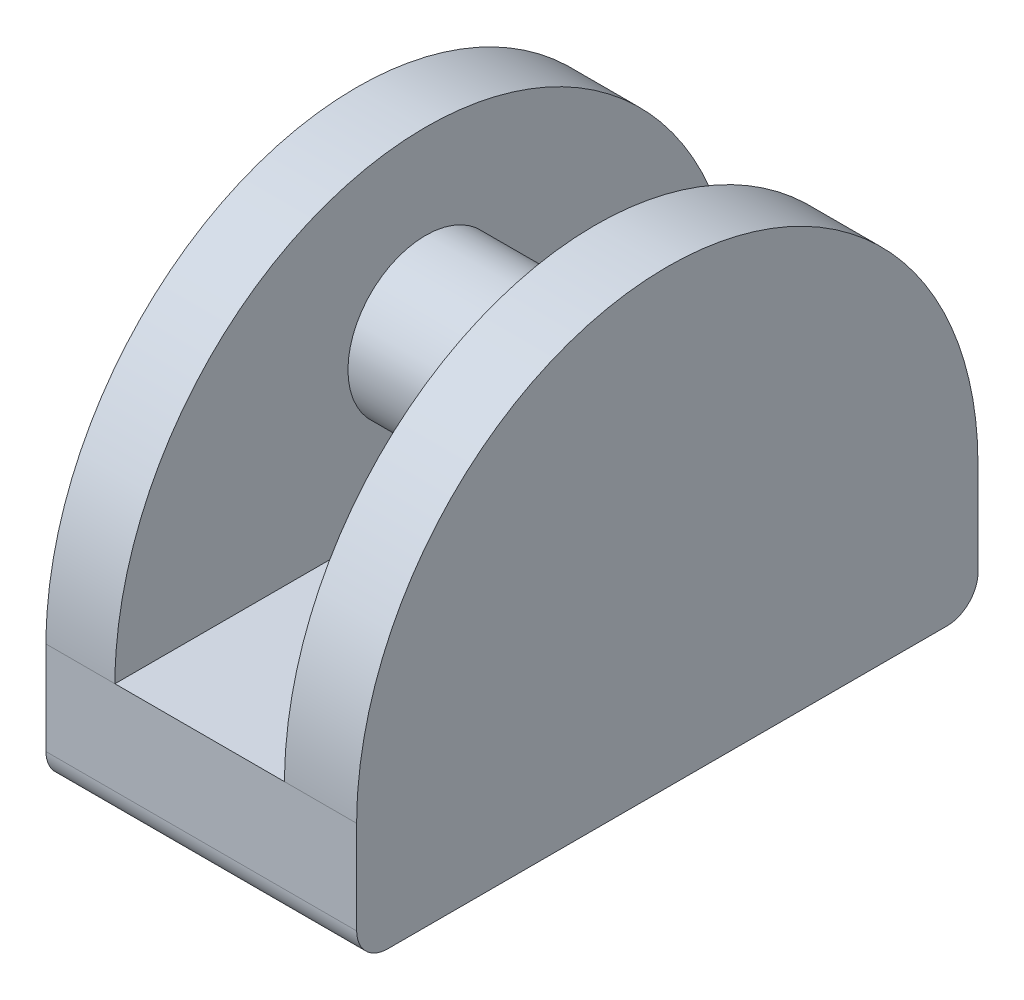
from build123d import *

# Parameters (mm, degrees)
SKETCH1_W           = 10
SKETCH1_H           = 2
BOSS_EXTRUDE1_DEPTH = 5
BOSS_EXTRUDE2_DEPTH = 5
SKETCH4_W           = 2.729572797
SKETCH4_H           = 10
CUT_EXTRUDE1_DEPTH  = 6
SKETCH5_R           = 1.25
BOSS_EXTRUDE3_DEPTH = 5
FILLET1_R           = 0.5


with BuildPart() as part:
    # Sketch1 → Boss-Extrude1 (new body)
    with BuildSketch(Plane(origin=(0, 0, 0), x_dir=(0, 0, -1), z_dir=(1, 0, 0))):
        with Locations((5, -1)):
            Rectangle(SKETCH1_W, SKETCH1_H)
    extrude(amount=BOSS_EXTRUDE1_DEPTH)

    # Sketch3 → Boss-Extrude2 (add)
    with BuildSketch(Plane(origin=(0, 0, 0), x_dir=(0, 0, -1), z_dir=(1, 0, 0))):
        with BuildLine():
            Line((0, 0), (10, 0))
            add(Edge.make_bspline(
                [(10, 0), (10.000000069, 5.258320959), (5, 5.258320959), (-6.9e-08, 5.258320959), (0, 0)],
                knots=[1.570796313, 1.570796313, 1.570796313, 3.141592654, 3.141592654, 4.712388994, 4.712388994, 4.712388994], degree=2, weights=[1, 0.707106776, 1, 0.707106776, 1]))
        make_face()
    extrude(amount=BOSS_EXTRUDE2_DEPTH)

    # Sketch4 → Cut-Extrude1 (cut)
    with BuildSketch(Plane(origin=(0, 0, 0), x_dir=(1, 0, 0), z_dir=(0, 1, 0))):
        with Locations((2.474489973, 5)):
            Rectangle(SKETCH4_W, SKETCH4_H)
    extrude(amount=CUT_EXTRUDE1_DEPTH, mode=Mode.SUBTRACT)

    # Sketch5 → Boss-Extrude3 (add)
    with BuildSketch(Plane.ZY):
        with Locations((-5, 2.5)):
            Circle(SKETCH5_R)
    extrude(amount=-BOSS_EXTRUDE3_DEPTH)

    # Fillet1
    fillet1_edges = [part.edges().sort_by_distance(p)[0] for p in [
        (2.5, -2, -10),
        (2.5, -2, 0),
    ]]
    fillet(fillet1_edges, radius=FILLET1_R)


solid = part.part
